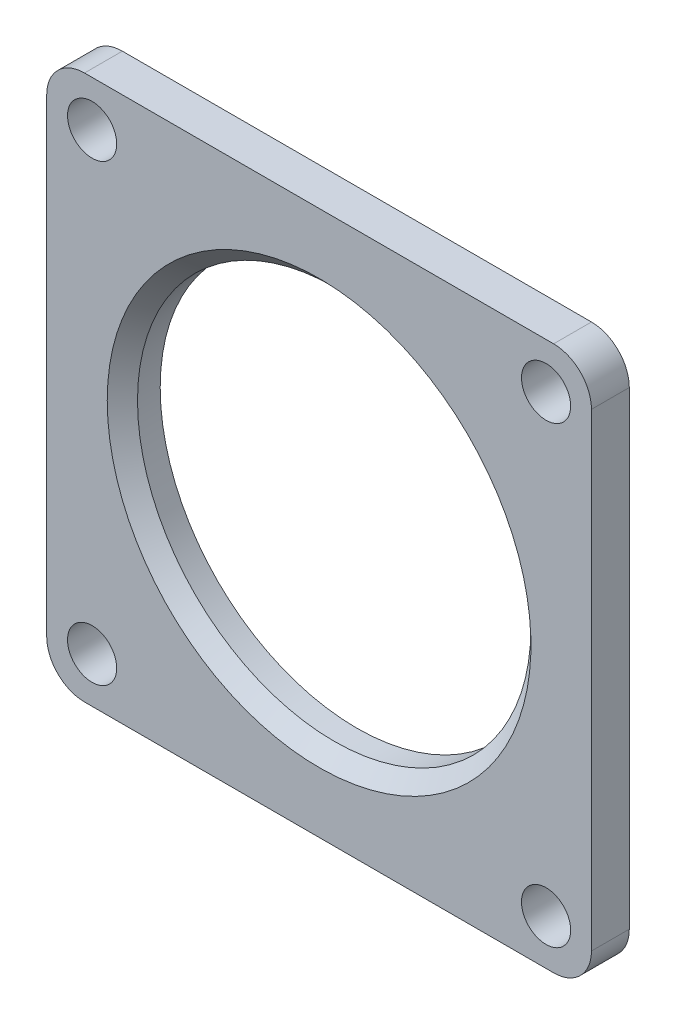
from build123d import *

# Parameters (mm, degrees)
SKETCH1_W           = 72
SKETCH1_H           = 72
BOSS_EXTRUDE1_DEPTH = 5
HOLE1_D             = 62.6
HOLE1_DEPTH         = 2.25
SKETCH4_W           = 27.8
SKETCH4_H           = 2.25
HOLE2_D             = 6.5
HOLE3_D             = 52
CHAMFER1_SIZE       = 2
FILLET1_R           = 5


with BuildPart() as part:
    # Sketch1 → Boss-Extrude1 (new body)
    with BuildSketch(Plane(origin=(0, 0, 0), x_dir=(-1, 0, 0), z_dir=(0, 0, -1))):
        with Locations((-36, 36)):
            Rectangle(SKETCH1_W, SKETCH1_H)
    extrude(amount=-BOSS_EXTRUDE1_DEPTH)

    # Hole1
    with Locations(Plane(origin=(0, 0, 0), x_dir=(-1, 0, 0), z_dir=(0, 0, -1))):
        with Locations((-36, 36)):
            Hole(HOLE1_D / 2, depth=HOLE1_DEPTH)

    # Sketch4 → Revolve1 (revolve)
    with BuildSketch(Plane(origin=(0, 36, 0), x_dir=(1, 0, 0), z_dir=(0, 1, 0)), mode=Mode.PRIVATE) as revolve1_sk:
        with Locations((49.9, -1.125)):
            Rectangle(SKETCH4_W, SKETCH4_H)
    revolve(revolve1_sk.sketch.rotate(Axis((36, 36, 0), (0, 0, 1)), 180), axis=Axis((36, 36, 0), (0, 0, 1)))

    # Hole2 (through all)
    with Locations(Plane.XY.offset(5)):
        with Locations((66, 6), (6, 6), (6, 66), (66, 66)):
            Hole(HOLE2_D / 2)

    # Hole3 (through all)
    with Locations(Plane.XY.offset(5)):
        with Locations((36, 36)):
            Hole(HOLE3_D / 2)

    # Chamfer1
    chamfer1_edges = [part.edges().sort_by_distance(p)[0] for p in [
        (62, 36, 5),
    ]]
    chamfer(chamfer1_edges, length=CHAMFER1_SIZE)

    # Fillet1
    fillet1_edges = [part.edges().sort_by_distance(p)[0] for p in [
        (72, 0, 2.5),
        (72, 72, 2.5),
        (0, 72, 2.5),
        (0, 0, 2.5),
    ]]
    fillet(fillet1_edges, radius=FILLET1_R)


solid = part.part
